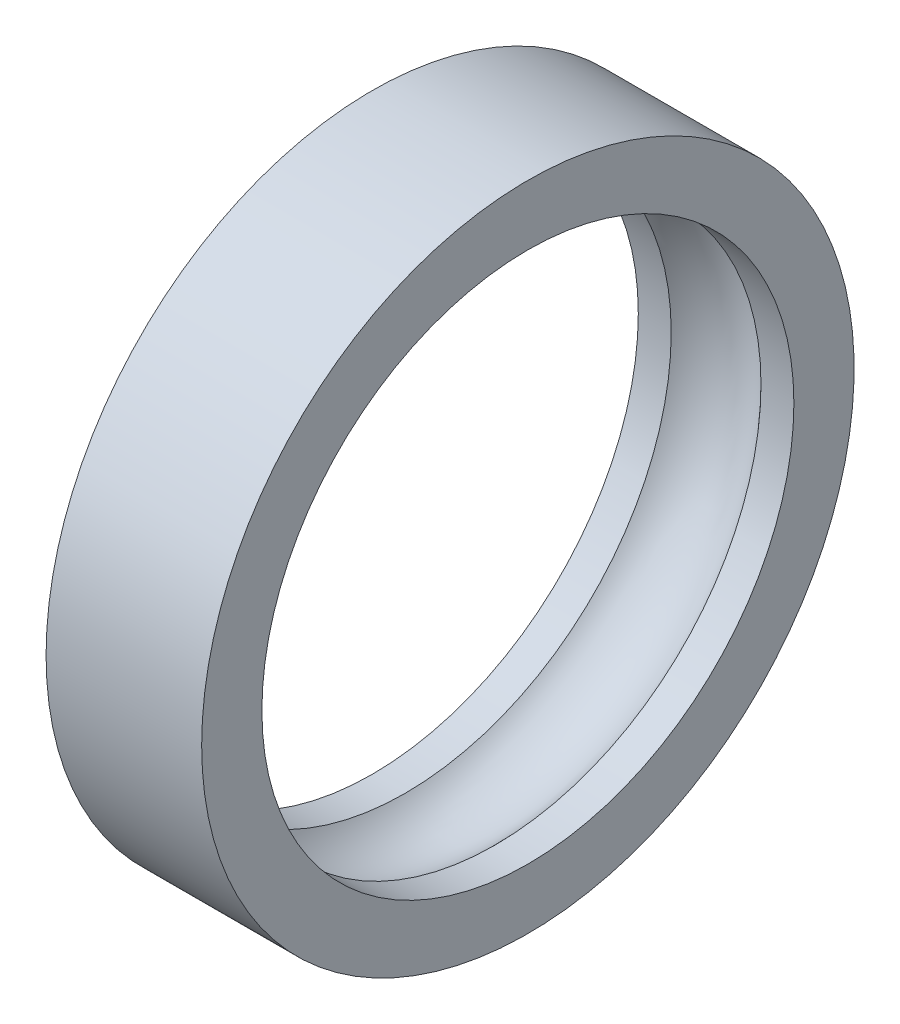
from build123d import *


with BuildPart() as part:
    # Sketch1 → Revolve1 (revolve)
    with BuildSketch(Plane.XY, mode=Mode.PRIVATE) as revolve1_sk:
        with BuildLine():
            Line((-15.5, 65), (15.5, 65))
            Line((15.5, 65), (15.5, 53))
            Line((15.5, 53), (8.94427191, 53))
            ThreePointArc((8.94427191, 53), (0, 57), (-8.94427191, 53))
            Line((-8.94427191, 53), (-15.5, 53))
            Line((-15.5, 53), (-15.5, 65))
        make_face()
    revolve(revolve1_sk.sketch.rotate(Axis((0, 0, 0), (1, 0, 0)), 90), axis=Axis((0, 0, 0), (1, 0, 0)))


solid = part.part
